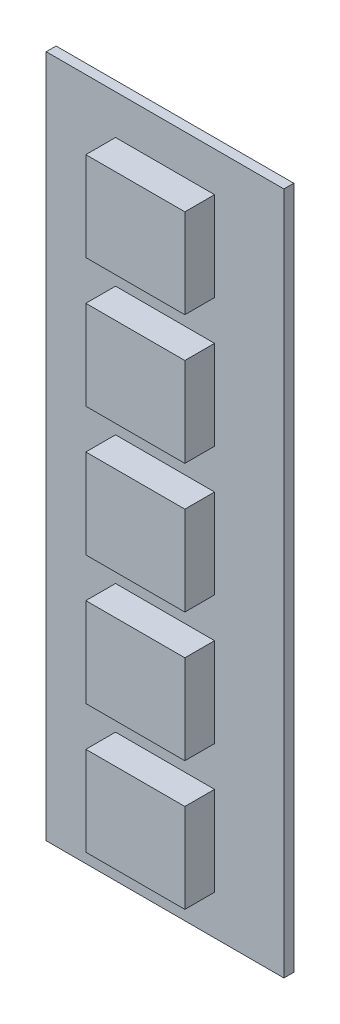
from build123d import *

# Parameters (mm, degrees)
ESQUISSE1_W        = 12
ESQUISSE1_H        = 34.5
BOSS_EXTRU_1_DEPTH = 0.5
ESQUISSE2_W        = 5
ESQUISSE2_H        = 4.5
BOSS_EXTRU_2_DEPTH = 1.5


with BuildPart() as part:
    # Esquisse1 → Boss.-Extru.1 (new body)
    with BuildSketch(Plane.XY):
        with Locations((-6, 18.013152108)):
            Rectangle(ESQUISSE1_W, ESQUISSE1_H)
    extrude(amount=BOSS_EXTRU_1_DEPTH)

    # Esquisse2 → Boss.-Extru.2 (add)
    with BuildSketch(Plane.XY.offset(0.5)):
        with Locations((-6, 31.013152108)):
            Rectangle(ESQUISSE2_W, ESQUISSE2_H)
        with Locations((-6, 24.513152108)):
            Rectangle(ESQUISSE2_W, ESQUISSE2_H)
        with Locations((-6, 18.013152108)):
            Rectangle(ESQUISSE2_W, ESQUISSE2_H)
        with Locations((-6, 11.513152108)):
            Rectangle(ESQUISSE2_W, ESQUISSE2_H)
        with Locations((-6, 5.013152108)):
            Rectangle(ESQUISSE2_W, ESQUISSE2_H)
    extrude(amount=BOSS_EXTRU_2_DEPTH)


solid = part.part
